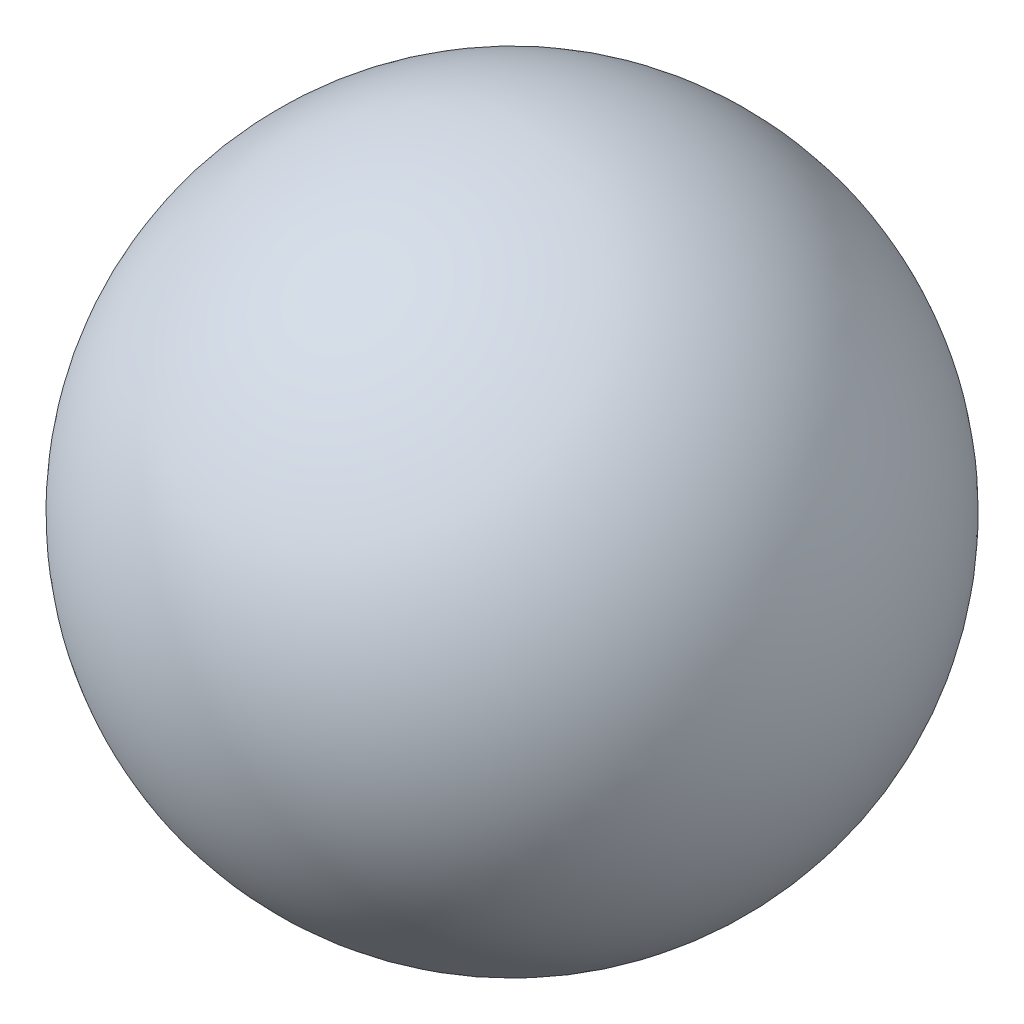
from build123d import *


with BuildPart() as part:
    # Sketch1 → Revolve2 (revolve)
    with BuildSketch(Plane(origin=(0, 0, 0), x_dir=(1, 0, 0), z_dir=(0, 1, 0))):
        with BuildLine():
            Line((0, 0), (0, -21.335))
            ThreePointArc((0, -21.335), (21.335, 0), (0, 21.335))
            Line((0, 21.335), (0, 0))
        make_face()
    revolve(axis=Axis((0, 0, -26.691521927), (0, 0, -1)))


solid = part.part
